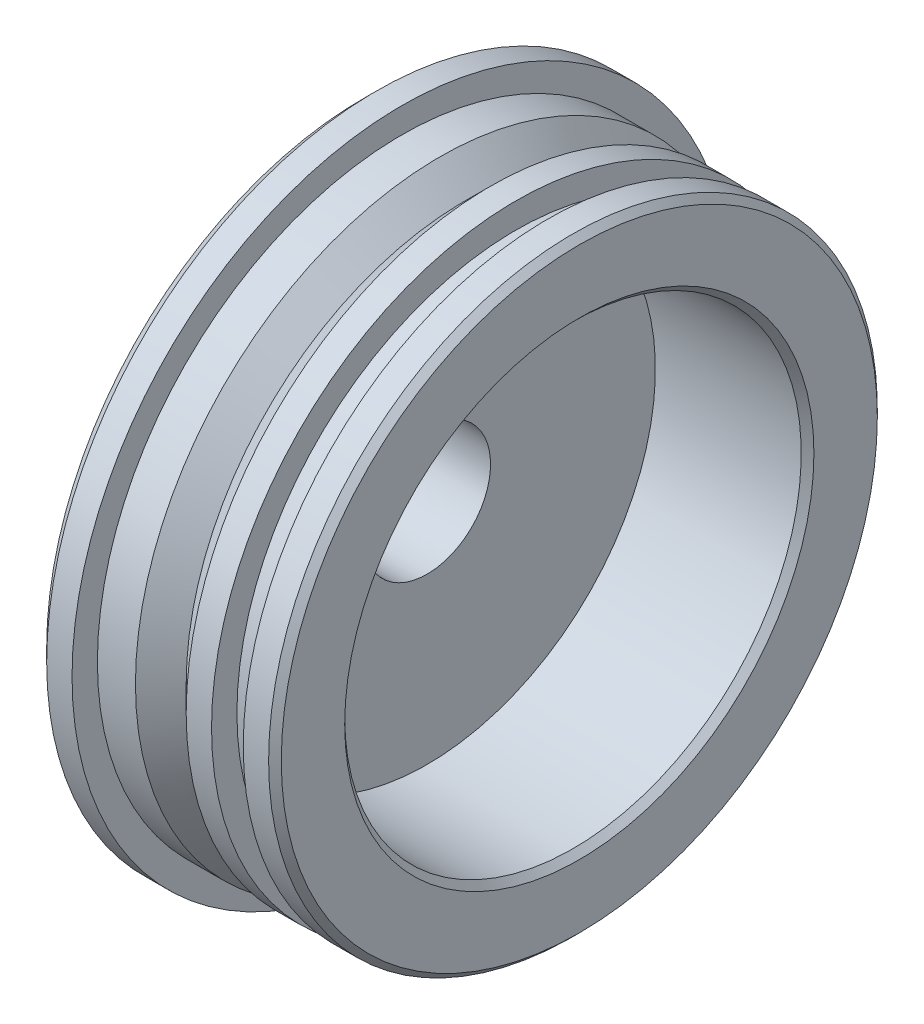
from build123d import *

# Parameters (mm, degrees)
SKETCH_2_R          = 5
CUT_EXTRUDE_1_DEPTH = 10


with BuildPart() as part:
    # Эскиз1 → Повернуть1 (revolve)
    with BuildSketch(Plane.XY, mode=Mode.PRIVATE) as revolve_1_sk:
        Polygon((-5, 0), (-5, 25), (-4, 26), (-2, 26), (-2, 24), (1, 24), (3, 22), (5, 24), (7, 24), (7, 22), (9.5, 22), (9.5, 24), (11.5, 24), (12, 23.5), (12, 18.5), (11.5, 18), (0, 18), (0, 0), align=None)
    revolve(revolve_1_sk.sketch.rotate(Axis((0, 0, 0), (1, 0, 0)), 90), axis=Axis((0, 0, 0), (1, 0, 0)))

    # Эскиз2 → Вырез-Вытянуть1 (cut)
    with BuildSketch(Plane.ZY.offset(5)):
        Circle(SKETCH_2_R)
    extrude(amount=-CUT_EXTRUDE_1_DEPTH, mode=Mode.SUBTRACT)


solid = part.part
